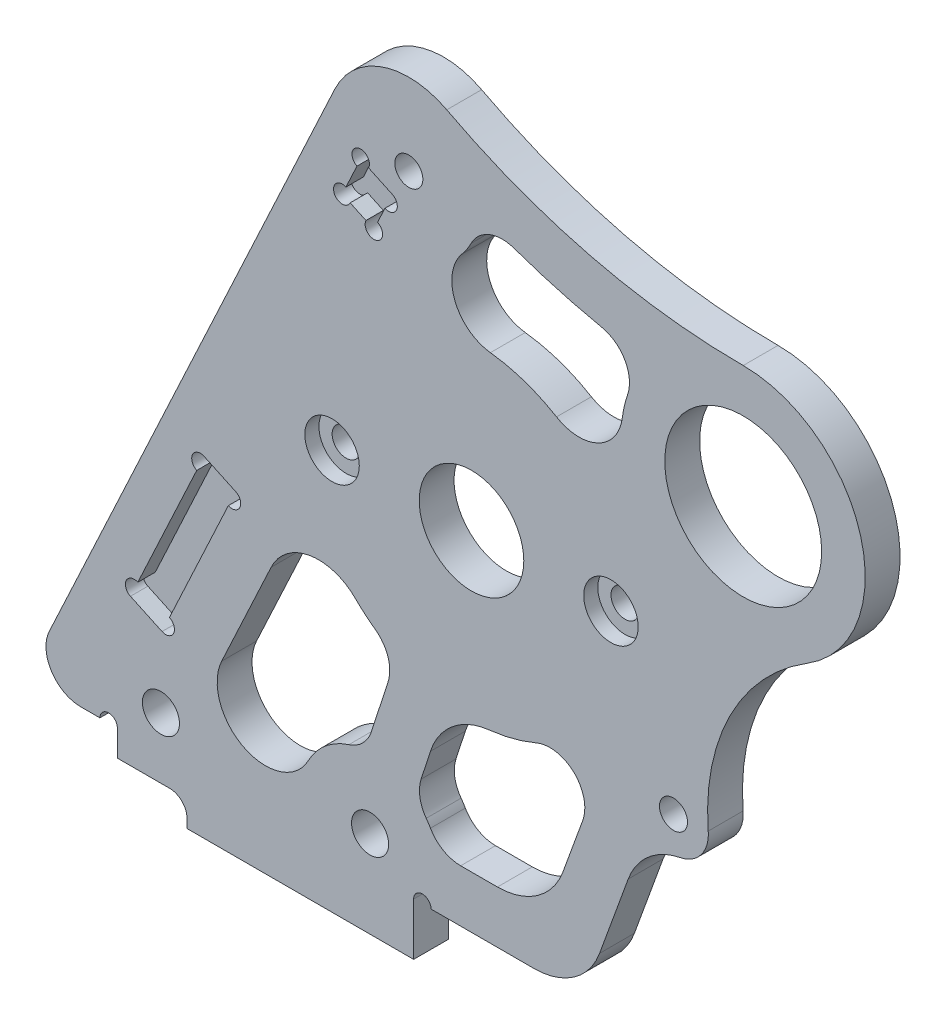
from build123d import *

# Parameters (mm, degrees)
SKETCH1_R                                       = 14.2875
BOSS_EXTRUDE1_DEPTH                             = 6.35
F_3_4_0_75_DIAMETER_HOLE1_D                     = 19.05
CBORE_FOR_10_BUTTON_HEAD_CAP_SCREW1_D           = 5.1054
CBORE_FOR_10_BUTTON_HEAD_CAP_SCREW1_CBORE_D     = 9.92124
CBORE_FOR_10_BUTTON_HEAD_CAP_SCREW1_CBORE_DEPTH = 2.5654
F_1_4_CLEARANCE_HOLE1_D                         = 6.7564
F_10_CLEARANCE_HOLE2_D                          = 5.1054
CUT_EXTRUDE2_DEPTH                              = 3.175
CUT_EXTRUDE3_DEPTH                              = 182.28977969


with BuildPart() as part:
    # Sketch1 → Boss-Extrude1 (new body)
    with BuildSketch(Plane.XY):
        with BuildLine():
            Line((-120.65, 0), (-117.17933671, 0))
            ThreePointArc((-117.17933671, 0), (-115.59183671, 1.5875), (-114.00433671, 0))
            Line((-114.00433671, 0), (-114.00433671, -4.7625))
            Line((-114.00433671, -4.7625), (-104.47933671, -4.7625))
            ThreePointArc((-104.47933671, -4.7625), (-102.234272679, -5.69243597), (-101.30433671, -7.9375))
            Line((-101.30433671, -7.9375), (-101.30433671, -9.525))
            Line((-101.30433671, -9.525), (-60.02933671, -9.525))
            Line((-60.02933671, -9.525), (-60.02933671, 0))
            ThreePointArc((-60.02933671, 0), (-58.44183671, 1.5875), (-56.85433671, 0))
            Line((-56.85433671, 0), (-38.1, 0))
            ThreePointArc((-38.1, 0), (-30.815579258, 2.296769038), (-26.165903716, 8.35634418))
            Line((-26.165903716, 8.35634418), (-20.945967504, 22.698001054))
            ThreePointArc((-20.945967504, 22.698001054), (-17.273923344, 27.999473263), (-11.471463484, 30.813896024))
            ThreePointArc((-11.471463484, 30.813896024), (-7.639410119, 33.209590086), (-6.371263462, 37.547306891))
            ThreePointArc((-6.371263462, 37.547306891), (-2.360982527, 57.822228263), (11.645315486, 73.020202003))
            ThreePointArc((11.645315486, 73.020202003), (21.385338266, 98.001275259), (0, 114.175))
            ThreePointArc((0, 114.175), (-27.81071387, 117.557961662), (-53.999382782, 127.509537225))
            ThreePointArc((-53.999382782, 127.509537225), (-65.649094725, 128.437962549), (-74.359242294, 120.64623031))
            Line((-74.359242294, 120.64623031), (-126.405054448, 9.033625962))
            ThreePointArc((-126.405054448, 9.033625962), (-126.005535681, 2.938147487), (-120.65, 0))
        make_face()
        with Locations((0, 91.95)):
            Circle(SKETCH1_R, mode=Mode.SUBTRACT)
    extrude(amount=BOSS_EXTRUDE1_DEPTH)

    # 3/4 (0.75) Diameter Hole1 (through all)
    with Locations(Plane.XY.offset(6.35)):
        with Locations((-49.493351826, 63.375)):
            Hole(F_3_4_0_75_DIAMETER_HOLE1_D / 2)

    # CBORE for #10 Button Head Cap Screw1 (through all)
    with Locations(Plane(origin=(0, 0, 6.35), x_dir=(-1, 0, 0), z_dir=(0, 0, 1))):
        with Locations((24.093351826, -63.375), (74.893351826, -63.375)):
            CounterBoreHole(CBORE_FOR_10_BUTTON_HEAD_CAP_SCREW1_D / 2, CBORE_FOR_10_BUTTON_HEAD_CAP_SCREW1_CBORE_D / 2, CBORE_FOR_10_BUTTON_HEAD_CAP_SCREW1_CBORE_DEPTH)

    # 1/4 Clearance Hole1 (through all)
    with Locations(Plane(origin=(0, 0, 0), x_dir=(-1, 0, 0), z_dir=(0, 0, -1))):
        with Locations((67.96683671, 6.35), (106.06683671, 6.35)):
            Hole(F_1_4_CLEARANCE_HOLE1_D / 2)

    # #10 Clearance Hole2 (through all)
    with Locations(Plane(origin=(0, 0, 0), x_dir=(-1, 0, 0), z_dir=(0, 0, -1))):
        with Locations((60.908084373, 114.37385236), (12.701259616, 37.043671419)):
            Hole(F_10_CLEARANCE_HOLE2_D / 2)

    # Sketch20 → Cut-Extrude2 (cut, symmetric)
    with BuildSketch(Plane(origin=(0, 0, 6.35), x_dir=(-1, 0, 0), z_dir=(0, 0, -1))):
        with BuildLine():
            Line((92.44330918, 48.057718602), (98.198363628, 50.741344564))
            ThreePointArc((98.198363628, 50.741344564), (100.30803373, 49.973487442), (99.540176609, 47.86381734))
            Line((99.540176609, 47.86381734), (110.274680457, 24.843599549))
            ThreePointArc((110.274680457, 24.843599549), (112.384350559, 24.075742428), (111.616493438, 21.966072325))
            Line((111.616493438, 21.966072325), (105.86143899, 19.282446363))
            ThreePointArc((105.86143899, 19.282446363), (103.751768888, 20.050303485), (104.519626009, 22.159973587))
            Line((104.519626009, 22.159973587), (93.785122161, 45.180191378))
            ThreePointArc((93.785122161, 45.180191378), (91.675452059, 45.948048499), (92.44330918, 48.057718602))
        make_face()
        with BuildLine():
            Line((70.34966907, 110.463062771), (72.362388541, 106.146771935))
            ThreePointArc((72.362388541, 106.146771935), (74.525057067, 104.165051345), (71.59453142, 104.037101832))
            Line((71.59453142, 104.037101832), (68.717004196, 102.695288851))
            ThreePointArc((68.717004196, 102.695288851), (66.735283607, 100.532620325), (66.607334094, 103.463145973))
            Line((66.607334094, 103.463145973), (65.265521113, 106.340673197))
            ThreePointArc((65.265521113, 106.340673197), (63.15585101, 107.108530318), (63.923708132, 109.21820042))
            Line((63.923708132, 109.21820042), (68.239998967, 111.230919892))
            ThreePointArc((68.239998967, 111.230919892), (70.221719557, 113.393588418), (70.34966907, 110.463062771))
        make_face()
    extrude(amount=CUT_EXTRUDE2_DEPTH, both=True, mode=Mode.SUBTRACT)

    # Sketch21 → Cut-Extrude3 (cut, through all)
    with BuildSketch(Plane(origin=(0, 0, 0), x_dir=(-1, 0, 0), z_dir=(0, 0, -1))):
        with BuildLine():
            Line((94.995724075, 20.045977116), (85.987083429, 39.365069327))
            ThreePointArc((85.987083429, 39.365069327), (79.023116956, 44.717335237), (70.640334696, 42.095782075))
            ThreePointArc((70.640334696, 42.095782075), (68.891484629, 40.490235554), (67.021153622, 39.028005027))
            ThreePointArc((67.021153622, 39.028005027), (64.697142252, 35.852583725), (64.690284199, 31.917576449))
            Line((64.690284199, 31.917576449), (67.728953723, 22.537639163))
            ThreePointArc((67.728953723, 22.537639163), (69.288161522, 19.996093098), (71.835528588, 18.446413648))
            ThreePointArc((71.835528588, 18.446413648), (76.138470899, 16.071851402), (79.217676493, 12.241400867))
            ThreePointArc((79.217676493, 12.241400867), (90.920159406, 8.434245512), (94.995724075, 20.045977116))
        make_face()
        with BuildLine():
            Line((51.469052768, 9.525), (44.769476801, 9.525))
            ThreePointArc((44.769476801, 9.525), (37.48505606, 11.821769038), (32.835380517, 17.88134418))
            Line((32.835380517, 17.88134418), (29.231939453, 27.781717136))
            ThreePointArc((29.231939453, 27.781717136), (30.834227059, 34.565634102), (37.696077358, 35.791956022))
            ThreePointArc((37.696077358, 35.791956022), (41.894327789, 34.353373001), (46.258868743, 33.549874364))
            ThreePointArc((46.258868743, 33.549874364), (52.902583174, 30.776932908), (56.971445845, 24.83786713))
            Line((56.971445845, 24.83786713), (58.667572518, 19.6021672))
            ThreePointArc((58.667572518, 19.6021672), (58.894836065, 16.629132278), (57.740046713, 13.880123927))
            ThreePointArc((57.740046713, 13.880123927), (57.33778938, 13.300780738), (56.968314082, 12.7))
            ThreePointArc((56.968314082, 12.7), (54.644052768, 10.375738686), (51.469052768, 9.525))
        make_face()
        with BuildLine():
            ThreePointArc((46.049330406, 93.17665627), (39.806875451, 91.768171282), (34.005177492, 89.067731575))
            ThreePointArc((34.005177492, 89.067731575), (26.46144828, 88.715057819), (22.036931884, 94.835179049))
            ThreePointArc((22.036931884, 94.835179049), (21.648773671, 96.978043711), (21.052760506, 99.072632947))
            ThreePointArc((21.052760506, 99.072632947), (21.553789247, 104.256924834), (25.764522177, 107.322481938))
            ThreePointArc((25.764522177, 107.322481938), (33.843976098, 109.298383447), (41.774843757, 111.804994829))
            ThreePointArc((41.774843757, 111.804994829), (46.260154558, 111.70723207), (49.56139318, 108.669240282))
            ThreePointArc((49.56139318, 108.669240282), (50.30920774, 107.37715213), (51.203478444, 106.181744954))
            ThreePointArc((51.203478444, 106.181744954), (52.517215708, 98.137202873), (46.049330406, 93.17665627))
        make_face()
    extrude(amount=-CUT_EXTRUDE3_DEPTH, mode=Mode.SUBTRACT)


solid = part.part
